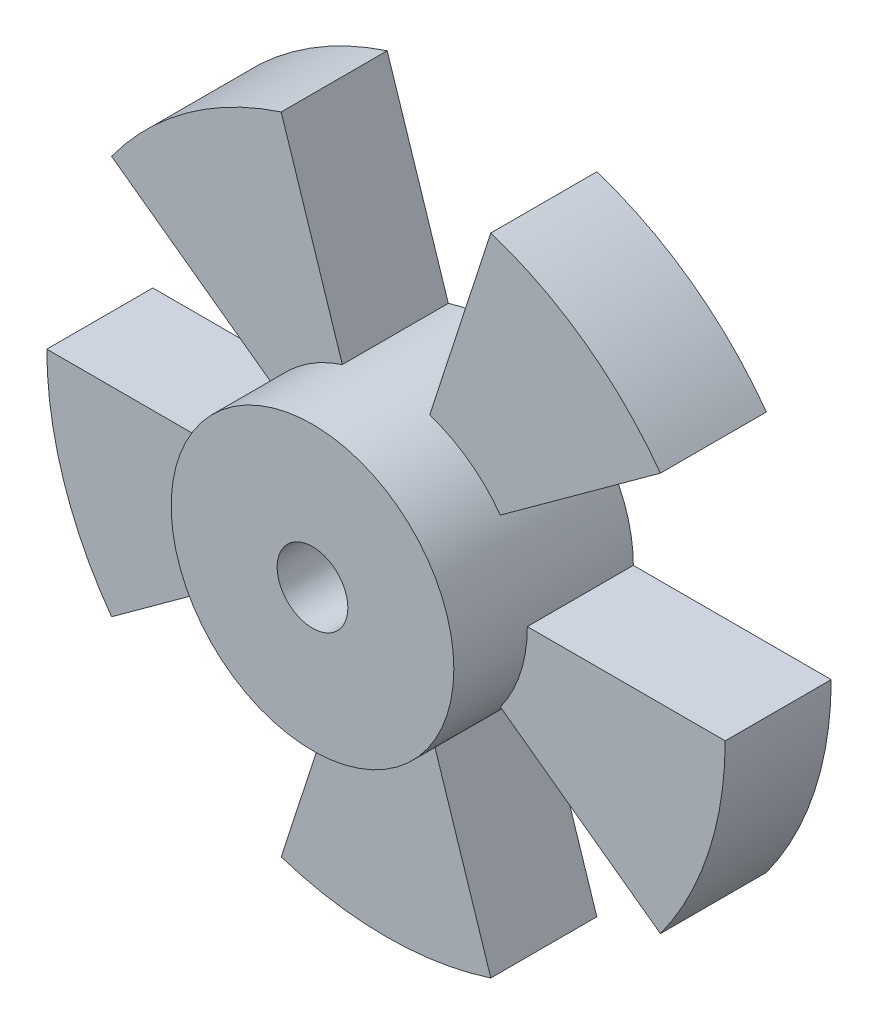
from build123d import *
from build123d.topology import SkipClean

# Parameters (mm, degrees)
SZKIC1_R                    = 4.8
DODANIE_WYCI_GNI_CIE1_DEPTH = 1.5
SZKIC2_R                    = 2
DODANIE_WYCI_GNI_CIE2_DEPTH = 1.5
WYTNIJ_WYCI_GNI_CIE1_REACH  = 8.952
SZYK_KO_OWY2_COUNT          = 5
OTW_R1_D                    = 1
ESBO_O1_R                   = 2
CORTE_EXTRUS_O1_DEPTH       = 0.46


with BuildPart() as part:
    # Szkic1 → Dodanie-wyciągnięcie1 (new body)
    with BuildSketch(Plane.XY):
        Circle(SZKIC1_R)
    extrude(amount=DODANIE_WYCI_GNI_CIE1_DEPTH)

    # Szkic2 → Dodanie-wyciągnięcie2 (add)
    with BuildSketch(Plane.XY.offset(1.5)):
        Circle(SZKIC2_R)
    extrude(amount=DODANIE_WYCI_GNI_CIE2_DEPTH)

    # Szkic3 → Wytnij-wyciągnięcie1 (cut, up to next)
    with BuildSketch(Plane.XY.offset(1.5), mode=Mode.PRIVATE) as wytnij_wyci_gni_cie1_sk1:
        with BuildLine():
            ThreePointArc((-0.618033989, 1.902113033), (-0.31286893, 1.975376681), (0, 2))
            Line((0, 2), (0, 4.8))
            ThreePointArc((0, 4.8), (-0.750885432, 4.740904035), (-1.483281573, 4.565071278))
            Line((-1.483281573, 4.565071278), (-0.618033989, 1.902113033))
        make_face()
    wytnij_wyci_gni_cie1_tool1 = extrude(wytnij_wyci_gni_cie1_sk1.sketch, amount=-WYTNIJ_WYCI_GNI_CIE1_REACH, mode=Mode.PRIVATE) & part.part
    # Szkic3 → Wytnij-wyciągnięcie1 (cut, up to next)
    with BuildSketch(Plane.XY.offset(1.5), mode=Mode.PRIVATE) as wytnij_wyci_gni_cie1_sk2:
        with BuildLine():
            Line((0, 4.8), (0, 2))
            ThreePointArc((0, 2), (0.31286893, 1.975376681), (0.618033989, 1.902113033))
            Line((0.618033989, 1.902113033), (1.483281573, 4.565071278))
            ThreePointArc((1.483281573, 4.565071278), (0.750885432, 4.740904035), (0, 4.8))
        make_face()
    wytnij_wyci_gni_cie1_tool2 = extrude(wytnij_wyci_gni_cie1_sk2.sketch, amount=-WYTNIJ_WYCI_GNI_CIE1_REACH, mode=Mode.PRIVATE) & part.part
    wytnij_wyci_gni_cie1_1 = wytnij_wyci_gni_cie1_tool1.solids().sort_by_distance((-0.559629, 3.533359, 1.5))[0]
    add(wytnij_wyci_gni_cie1_1, mode=Mode.SUBTRACT)
    wytnij_wyci_gni_cie1_2 = wytnij_wyci_gni_cie1_tool2.solids().sort_by_distance((0.559629, 3.533359, 1.5))[0]
    add(wytnij_wyci_gni_cie1_2, mode=Mode.SUBTRACT)
    wytnij_wyci_gni_cie1 = wytnij_wyci_gni_cie1_1 + wytnij_wyci_gni_cie1_2  # Wytnij-wyciągnięcie1 as one shape, for the pattern or mirror that repeats it

    # Szyk kołowy2: Wytnij-wyciągnięcie1 ×5 about axis
    with SkipClean():  # the faces are left unmerged after this step: merging them gives an invalid solid
        szyk_ko_owy2_axis = Axis((0, 0, 0), (0, 0, 1))
        for i in range(1, SZYK_KO_OWY2_COUNT):
            add(wytnij_wyci_gni_cie1.rotate(szyk_ko_owy2_axis, i * 360 / SZYK_KO_OWY2_COUNT), mode=Mode.SUBTRACT)

    # Otwór1 (through all)
    with Locations(Plane.XY.offset(3)):
        with Locations((0, 0)):
            Hole(OTW_R1_D / 2)

    # Esboço1 → Corte-extrusão1 (cut)
    with SkipClean():  # the faces are left unmerged after this step: merging them gives an invalid solid
        with BuildSketch(Plane.XY.offset(3)):
            Circle(ESBO_O1_R)
        extrude(amount=-CORTE_EXTRUS_O1_DEPTH, mode=Mode.SUBTRACT)


solid = part.part
